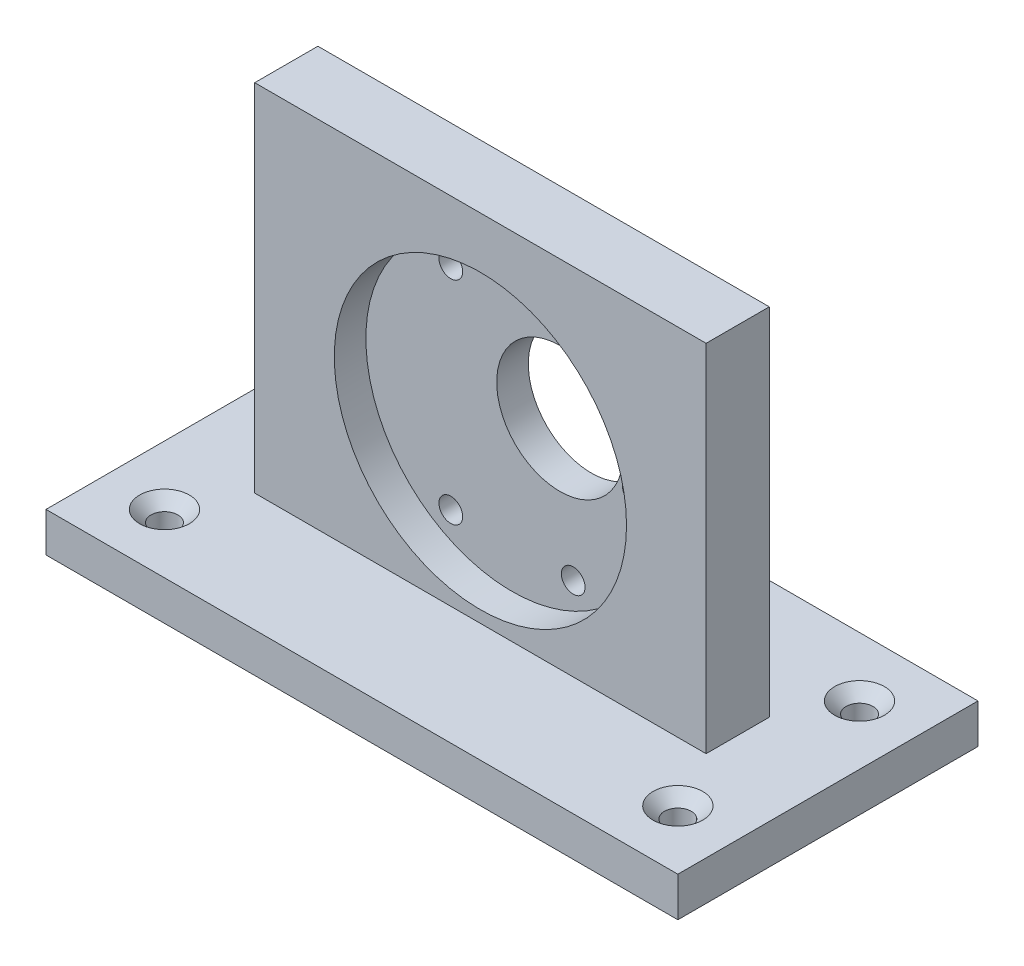
from build123d import *

# Parameters (mm, degrees)
SKETCH3_W                                       = 57.15
SKETCH3_H                                       = 50
BOSS_EXTRUDE1_DEPTH                             = 8
SKETCH3_3_R                                     = 1.5
SKETCH3_3_R_2                                   = 8
CUT_EXTRUDE2_DEPTH                              = 10
SKETCH4_R                                       = 18.5
CUT_EXTRUDE3_DEPTH                              = 4
BOSS_EXTRUDE2_DEPTH                             = 15
BOSS_EXTRUDE2_DEPTH_BACK                        = 23
SKETCH6_W                                       = 80
SKETCH6_H                                       = 5
CSK_FOR_M3_FLAT_HEAD_MACHINE_SCREW1_D           = 3.4
CSK_FOR_M3_FLAT_HEAD_MACHINE_SCREW1_CSINK_D     = 6.3
CSK_FOR_M3_FLAT_HEAD_MACHINE_SCREW1_CSINK_ANGLE = 90
SKETCH13_R                                      = 7.239
SKETCH13_R_2                                    = 5.334
BOSS_EXTRUDE4_DEPTH                             = 2.54
CUT_EXTRUDE6_REACH                              = 544.7
SKETCH16_R                                      = 1.7
CUT_EXTRUDE7_START                              = -3.175
SKETCH13_2_R                                    = 5.334
CUT_EXTRUDE7_DEPTH                              = 3.175


with BuildPart() as part:
    # Sketch3 → Boss-Extrude1 (new body)
    with BuildSketch(Plane.XY):
        with Locations((0, 25)):
            Rectangle(SKETCH3_W, SKETCH3_H)
    extrude(amount=BOSS_EXTRUDE1_DEPTH)

    # Sketch3<3> → Cut-Extrude2 (cut)
    with BuildSketch(Plane.XY):
        with Locations(Location((-7.75, 38.423393759, 0), (0, 0, 180))):
            Circle(SKETCH3_3_R)
        with Locations(Location((7.75, 38.423393759, 0), (0, 0, 180))):
            Circle(SKETCH3_3_R)
        with Locations(Location((-7.75, 11.576606241, 0), (0, 0, 180))):
            Circle(SKETCH3_3_R)
        with Locations(Location((7.75, 11.576606241, 0), (0, 0, 180))):
            Circle(SKETCH3_3_R)
        with Locations(Location((15.5, 25, 0), (0, 0, 180))):
            Circle(SKETCH3_3_R)
        with Locations(Location((6.062177825, 28.499999999, 0), (0, 0, 180))):
            Circle(SKETCH3_3_R_2)
    extrude(amount=CUT_EXTRUDE2_DEPTH, mode=Mode.SUBTRACT)

    # Sketch4 → Cut-Extrude3 (cut)
    with BuildSketch(Plane.XY.offset(8)):
        with Locations((0, 25)):
            Circle(SKETCH4_R)
    extrude(amount=-CUT_EXTRUDE3_DEPTH, mode=Mode.SUBTRACT)

    # Sketch6 → Boss-Extrude2 (add, two sides: drawn at the far end of the back side and taken through both)
    with BuildSketch(Plane.XY.offset(8).offset(-BOSS_EXTRUDE2_DEPTH_BACK)):
        with Locations((0, 2.5)):
            Rectangle(SKETCH6_W, SKETCH6_H)
    extrude(amount=BOSS_EXTRUDE2_DEPTH + BOSS_EXTRUDE2_DEPTH_BACK)

    # CSK for M3 Flat Head Machine Screw1 (through all)
    with Locations(Plane(origin=(0, 5, 0), x_dir=(1, 0, 0), z_dir=(0, 1, 0))):
        with Locations((-32.5, 7.5), (-32.5, -15.5), (32.5, -15.5), (32.5, 7.5)):
            CounterSinkHole(CSK_FOR_M3_FLAT_HEAD_MACHINE_SCREW1_D / 2, CSK_FOR_M3_FLAT_HEAD_MACHINE_SCREW1_CSINK_D / 2, counter_sink_angle=CSK_FOR_M3_FLAT_HEAD_MACHINE_SCREW1_CSINK_ANGLE)

    # Sketch13 → Boss-Extrude4 (add)
    with BuildSketch(Plane(origin=(0, 0, 0), x_dir=(-1, 0, 0), z_dir=(0, 0, -1))):
        with Locations((20.337822175, 28.499999999)):
            Circle(SKETCH13_R)
        with Locations((20.337822175, 28.499999999)):
            Circle(SKETCH13_R_2, mode=Mode.SUBTRACT)
    extrude(amount=BOSS_EXTRUDE4_DEPTH)

    # Sketch16 → Cut-Extrude6 (cut, up to next)
    with BuildSketch(Plane(origin=(-499.248949842, 16.821159134, -28.308871479), x_dir=(0.050830850863696445, -0.0009181581696577921, 0.9987068546806156), z_dir=(0.036090886531912156, 0.9993480899541041, -0.0009181581696584951)), mode=Mode.PRIVATE) as cut_extrude6_sk1:
        with Locations((44.5, 464.499999998)):
            Circle(SKETCH16_R)
    cut_extrude6_tool1 = extrude(cut_extrude6_sk1.sketch, amount=-CUT_EXTRUDE6_REACH, mode=Mode.PRIVATE) & part.part
    add(cut_extrude6_tool1.solids().sort_by_distance((-33.390455, 0.016084, -7.477347))[0], mode=Mode.SUBTRACT)

    # Sketch13<2> → Cut-Extrude7 (cut)
    with BuildSketch(Plane(origin=(0, 0, 0), x_dir=(-1, 0, 0), z_dir=(0, 0, -1)).offset(CUT_EXTRUDE7_START)):
        with Locations((20.337822175, 28.499999999)):
            Circle(SKETCH13_2_R)
    extrude(amount=CUT_EXTRUDE7_DEPTH, mode=Mode.SUBTRACT)


solid = part.part
